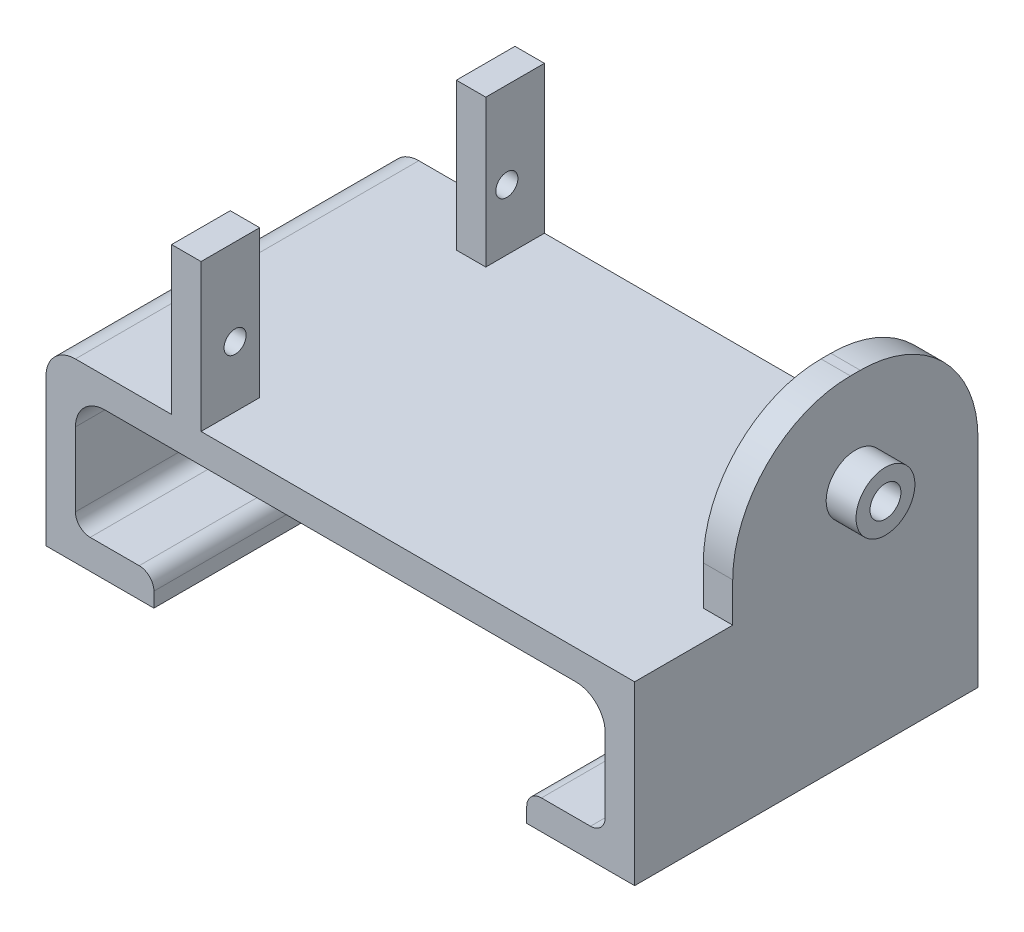
from build123d import *

# Parameters (mm, degrees)
BOSS_EXTRUDE1_DEPTH     = 35
SKETCH3_R               = 1.575
CUT_EXTRUDE1_DEPTH      = 10
CUT_EXTRUDE2_DEPTH      = 79.70196948
CUT_EXTRUDE2_DEPTH_BACK = 10
SKETCH5_W               = 10
SKETCH5_H               = 16
FILLET2_R               = 12
FILLET3_R               = 3
FILLET4_R               = 1.5
SKETCH6_W               = 3
SKETCH6_H               = 5.976707935
BOSS_EXTRUDE2_DEPTH     = 15
SKETCH8_R               = 1.125
CUT_EXTRUDE3_DEPTH      = 25
SKETCH10_R              = 3
BOSS_EXTRUDE3_DEPTH     = 3.044394089
SKETCH11_R              = 1.575
CUT_EXTRUDE4_DEPTH      = 7.5


with BuildPart() as part:
    # Sketch2 → Boss-Extrude1 (new body)
    with BuildSketch(Plane.XY):
        Polygon((27, 21), (27, 37), (30, 37), (30, 3), (19, 3), (19, 6), (27, 6), (27, 18), (-27, 18), (-27, 6), (-19, 6), (-19, 3), (-30, 3), (-30, 21), align=None)
    extrude(amount=-BOSS_EXTRUDE1_DEPTH)

    # Sketch3 → Cut-Extrude1 (cut)
    with BuildSketch(Plane(origin=(0, 0, 0), x_dir=(1, 0, 0), z_dir=(0, 1, 0))):
        with Locations(Location((-22.449984171, 16, 0), (0, 0, 90))):
            Circle(SKETCH3_R)
        with Locations(Location((22.550015829, 16, 0), (0, 0, 90))):
            Circle(SKETCH3_R)
    extrude(amount=CUT_EXTRUDE1_DEPTH, mode=Mode.SUBTRACT)

    # Sketch5 → Cut-Extrude2 (cut, two sides: drawn at the far end of the back side and taken through both)
    with BuildSketch(Plane(origin=(30, 0, 0), x_dir=(0, 0, -1), z_dir=(1, 0, 0)).offset(-CUT_EXTRUDE2_DEPTH_BACK)):
        with Locations((5, 29)):
            Rectangle(SKETCH5_W, SKETCH5_H)
    extrude(amount=CUT_EXTRUDE2_DEPTH + CUT_EXTRUDE2_DEPTH_BACK, mode=Mode.SUBTRACT)

    # Fillet2
    fillet2_edges = [part.edges().sort_by_distance(p)[0] for p in [
        (28.5, 37, -10),
        (28.5, 37, -35),
    ]]
    fillet(fillet2_edges, radius=FILLET2_R)

    # Fillet3
    fillet3_edges = [part.edges().sort_by_distance(p)[0] for p in [
        (27, 18, -17.5),
        (-27, 18, -17.5),
        (-30, 21, -17.5),
    ]]
    fillet(fillet3_edges, radius=FILLET3_R)

    # Fillet4
    fillet4_edges = [part.edges().sort_by_distance(p)[0] for p in [
        (19, 6, -17.5),
        (27, 6, -17.5),
        (-27, 6, -17.5),
        (-19, 6, -17.5),
    ]]
    fillet(fillet4_edges, radius=FILLET4_R)

    # Sketch6 → Boss-Extrude2 (add)
    with BuildSketch(Plane(origin=(0, 21, 0), x_dir=(1, 0, 0), z_dir=(0, 1, 0))):
        with Locations((-15.696239988, 32.011646033)):
            Rectangle(SKETCH6_W, SKETCH6_H)
        with Locations((-15.696239988, 2.988353968)):
            Rectangle(SKETCH6_W, SKETCH6_H)
    extrude(amount=BOSS_EXTRUDE2_DEPTH)

    # Sketch8 → Cut-Extrude3 (cut)
    with BuildSketch(Plane(origin=(0, 0, 0), x_dir=(0, 0, -1), z_dir=(1, 0, 0))):
        with Locations(Location((3.473292065, 27.2, 0), (0, 0, 270))):
            Circle(SKETCH8_R)
        with Locations(Location((31.173292065, 27.2, 0), (0, 0, 90))):
            Circle(SKETCH8_R)
    extrude(amount=-CUT_EXTRUDE3_DEPTH, mode=Mode.SUBTRACT)

    # Sketch10 → Boss-Extrude3 (add)
    with BuildSketch(Plane(origin=(30, 0, 0), x_dir=(0, 0, -1), z_dir=(1, 0, 0))):
        with Locations(Location((22.523292065, 27.2, 0), (0, 0, 270))):
            Circle(SKETCH10_R)
    extrude(amount=BOSS_EXTRUDE3_DEPTH)

    # Sketch11 → Cut-Extrude4 (cut, symmetric)
    with BuildSketch(Plane(origin=(30, 0, 0), x_dir=(0, 0, -1), z_dir=(1, 0, 0))):
        with Locations(Location((22.523292065, 27.2, 0), (0, 0, 270))):
            Circle(SKETCH11_R)
    extrude(amount=CUT_EXTRUDE4_DEPTH, both=True, mode=Mode.SUBTRACT)


solid = part.part
